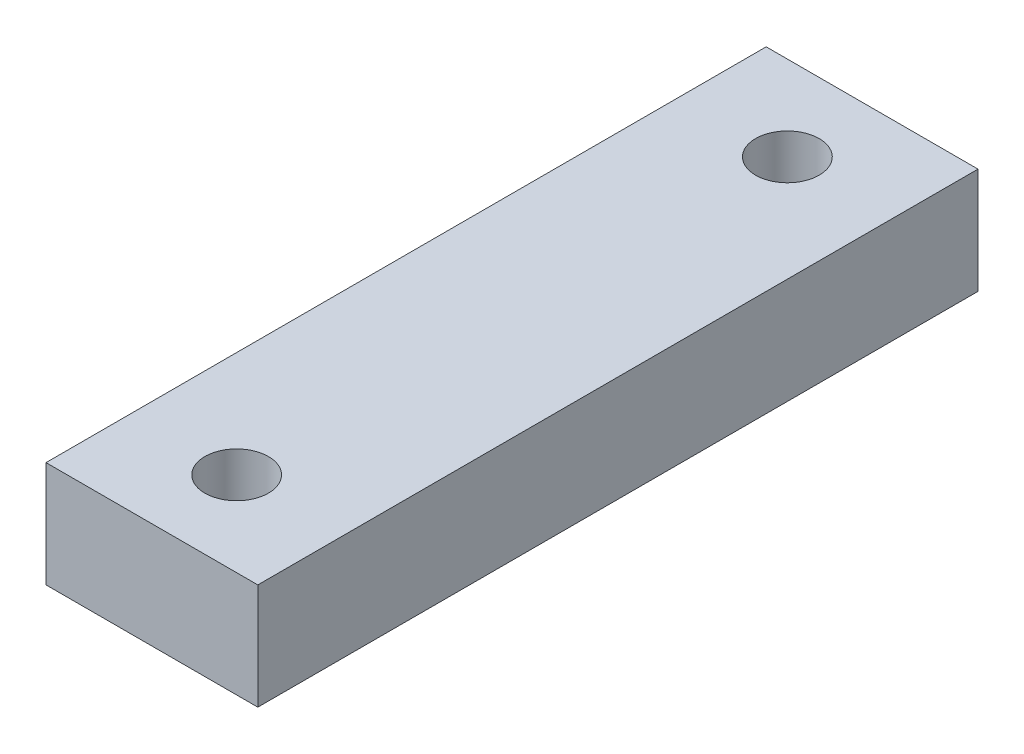
from build123d import *

# Parameters (mm, degrees)
SKETCH1_W           = 50
SKETCH1_H           = 25
BOSS_EXTRUDE1_DEPTH = 170
SKETCH2_R           = 7.5
CUT_EXTRUDE1_DEPTH  = 179.955301682
SKETCH3_R           = 7.5
CUT_EXTRUDE2_DEPTH  = 170


with BuildPart() as part:
    # Sketch1 → Boss-Extrude1 (new body)
    with BuildSketch(Plane.XY):
        with Locations((25, -12.5)):
            Rectangle(SKETCH1_W, SKETCH1_H)
    extrude(amount=BOSS_EXTRUDE1_DEPTH)

    # Sketch2 → Cut-Extrude1 (cut, through all)
    with BuildSketch(Plane(origin=(0, 0, 0), x_dir=(1, 0, 0), z_dir=(0, 1, 0))):
        with Locations(Location((25, -20, 0), (0, 0, 180))):
            Circle(SKETCH2_R)
    extrude(amount=-CUT_EXTRUDE1_DEPTH, mode=Mode.SUBTRACT)

    # Sketch3 → Cut-Extrude2 (cut)
    with BuildSketch(Plane(origin=(0, 0, 0), x_dir=(1, 0, 0), z_dir=(0, 1, 0))):
        with Locations(Location((25, -150, 0), (0, 0, 270))):
            Circle(SKETCH3_R)
    extrude(amount=-CUT_EXTRUDE2_DEPTH, mode=Mode.SUBTRACT)


solid = part.part
